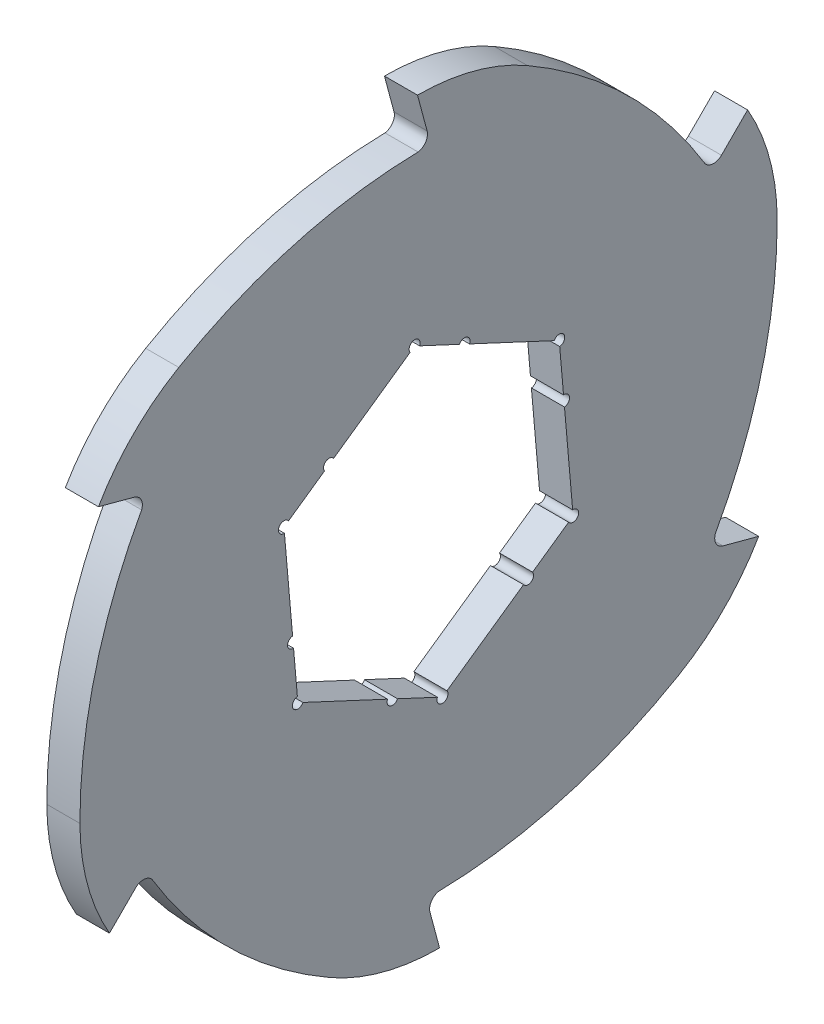
from build123d import *

# Parameters (mm, degrees)
SKETCH1_R                = 59
EXTRUDE1_DEPTH           = 3
EXTRUDE2_DEPTH           = 3
CIRPATTERN1_COUNT        = 6
F_2_0_2_DIAMETER_HOLE1_D = 2
F_2_0_2_DIAMETER_HOLE3_D = 2
CIRPATTERN2_COUNT        = 6


with BuildPart() as part:
    # Sketch1 → Extrude1 (new, symmetric)
    with BuildSketch(Plane(origin=(0, 0, 0), x_dir=(0, 0, -1), z_dir=(1, 0, 0))):
        Circle(SKETCH1_R)
        Polygon((23.694176429, 16.590840947), (-2.521001516, 28.815179183), (-26.215177945, 12.224338236), (-23.694176429, -16.590840947), (2.521001516, -28.815179183), (26.215177945, -12.224338236), align=None, mode=Mode.SUBTRACT)
    extrude(amount=EXTRUDE1_DEPTH, both=True)

    # Sketch2 → Extrude2 (add, symmetric)
    with BuildSketch(Plane(origin=(0, 0, 0), x_dir=(0, 0, -1), z_dir=(1, 0, 0))):
        with BuildLine():
            Line((-2, 67.961805723), (-0.262709442, 61.478149092))
            ThreePointArc((-0.262709442, 61.478149092), (-0.58620663, 59.77173183), (-2.122608272, 58.961805723))
            ThreePointArc((-2.122608272, 58.961805723), (28.679663449, 51.560419941), (51.21368579, 29.294340542))
            ThreePointArc((51.21368579, 29.294340542), (36.791707484, 48.186627241), (17.927108603, 62.644803614))
            ThreePointArc((17.927108603, 62.644803614), (8.312130826, 66.609702921), (-2, 67.961805723))
        make_face()
    extrude2 = extrude(amount=EXTRUDE2_DEPTH, both=True)

    # CirPattern1: Extrude2 ×6 about axis
    cirpattern1_axis = Axis((0, 0, 0), (1, 0, 0))
    for i in range(1, CIRPATTERN1_COUNT):
        add(extrude2.rotate(cirpattern1_axis, i * 360 / CIRPATTERN1_COUNT))

    # Ø2.0 (2) Diameter Hole1 (through all)
    with Locations(Plane(origin=(3, 0, 0), x_dir=(0, 0, -1), z_dir=(1, 0, 0))):
        with Locations((-2.521001516, 28.815179183), (23.694176429, 16.590840947), (26.215177945, -12.224338236), (2.521001516, -28.815179183), (-23.694176429, -16.590840947), (-26.215177945, 12.224338236)):
            Hole(F_2_0_2_DIAMETER_HOLE1_D / 2)

    # Ø2.0 (2) Diameter Hole3 (through all)
    with Locations(Plane(origin=(3, 0, 0), x_dir=(0, 0, -1), z_dir=(1, 0, 0))):
        with Locations((6.519493728, 24.599527017)):
            f_2_0_2_diameter_hole3 = Hole(F_2_0_2_DIAMETER_HOLE3_D / 2)

    # CirPattern2: Ø2.0 (2) Diameter Hole3 ×6 about axis
    cirpattern2_axis = Axis((0, 0, 0), (1, 0, 0))
    for i in range(1, CIRPATTERN2_COUNT):
        add(f_2_0_2_diameter_hole3.rotate(cirpattern2_axis, i * 360 / CIRPATTERN2_COUNT), mode=Mode.SUBTRACT)


solid = part.part
